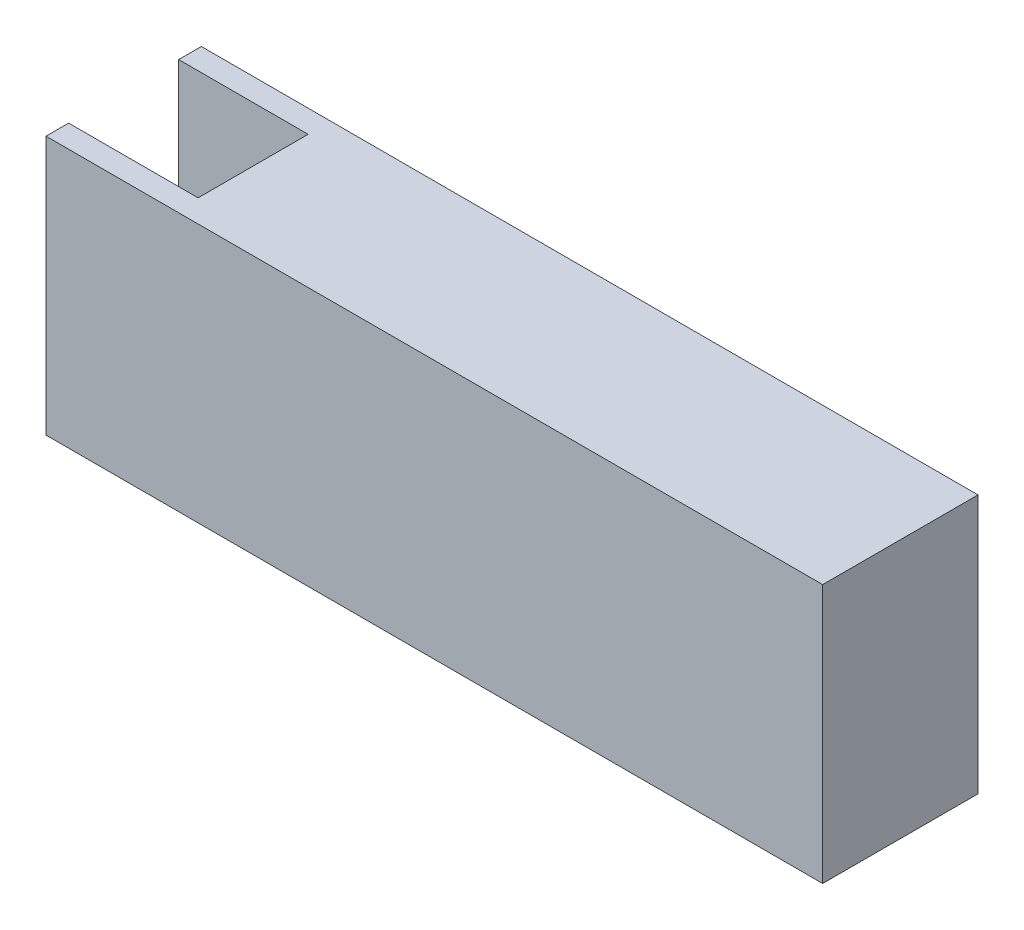
from build123d import *

# Parameters (mm, degrees)
SKETCH1_W           = 30
SKETCH1_H           = 6
BOSS_EXTRUDE1_DEPTH = 10
SKETCH1_4_W         = 5
SKETCH1_4_H         = 4.25
CUT_EXTRUDE1_DEPTH  = 31.822070015


with BuildPart() as part:
    # Sketch1 → Boss-Extrude1 (new body)
    with BuildSketch(Plane(origin=(0, 0, 0), x_dir=(1, 0, 0), z_dir=(0, 1, 0))):
        with Locations((14, 0)):
            Rectangle(SKETCH1_W, SKETCH1_H)
    extrude(amount=BOSS_EXTRUDE1_DEPTH)

    # Sketch1<4> → Cut-Extrude1 (cut, through all)
    with BuildSketch(Plane(origin=(0, 0, 0), x_dir=(1, 0, 0), z_dir=(0, 1, 0))):
        with Locations((1.5, 0)):
            Rectangle(SKETCH1_4_W, SKETCH1_4_H)
    extrude(amount=CUT_EXTRUDE1_DEPTH, mode=Mode.SUBTRACT)


solid = part.part
